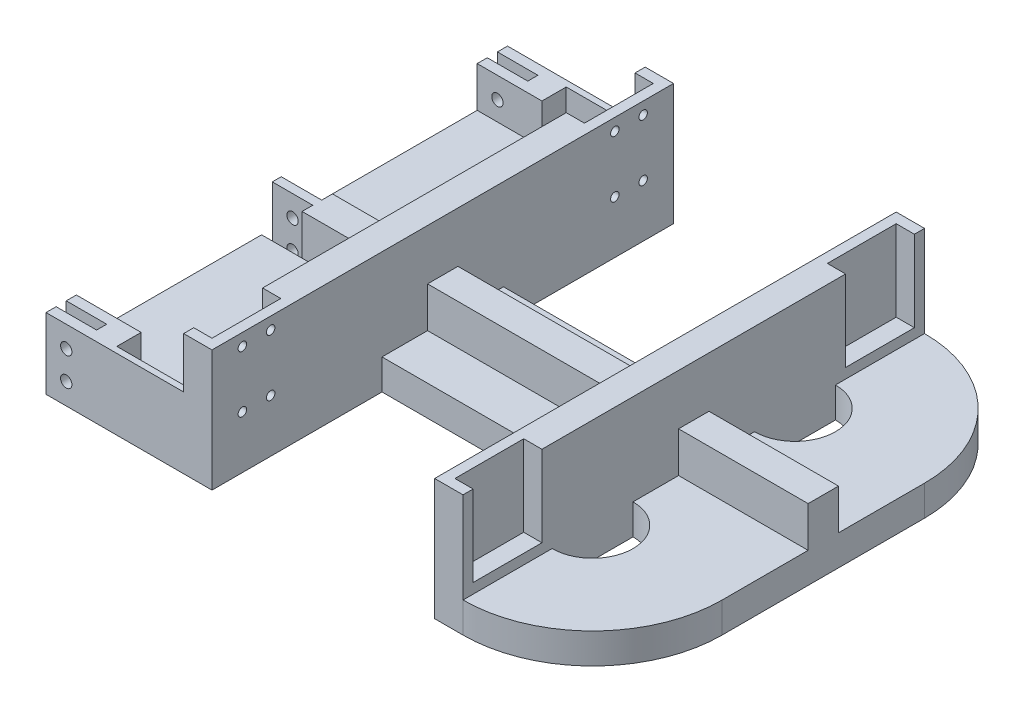
from build123d import *

# Parameters (mm, degrees)
BOSS_EXTRUDE1_DEPTH      = 2.5
BOSS_EXTRUDE1_DEPTH_BACK = 5
SKETCH3_W                = 7
SKETCH3_H                = 22
BOSS_EXTRUDE4_DEPTH      = 2.5
BOSS_EXTRUDE5_DEPTH      = 20
SKETCH7_R                = 3.75
BOSS_EXTRUDE6_DEPTH      = 5.5
SKETCH10_R               = 1.05
CUT_EXTRUDE1_DEPTH       = 2.5
SKETCH14_W               = 125
SKETCH14_H               = 7.5
SKETCH14_W_2             = 18
SKETCH14_H_2             = 1.5
BOSS_EXTRUDE8_DEPTH      = 10
SKETCH15_W               = 2.2
SKETCH15_H               = 17.5
SKETCH15_W_2             = 2.5
BOSS_EXTRUDE9_DEPTH      = 10
SKETCH16_R               = 1.4
CUT_EXTRUDE3_DEPTH       = 114
SKETCH17_W               = 7
SKETCH17_H               = 30
BOSS_EXTRUDE10_DEPTH     = 70
SKETCH18_W               = 45.75
SKETCH18_H               = 7.5
BOSS_EXTRUDE11_DEPTH     = 10


with BuildPart() as part:
    # Sketch2 → Boss-Extrude1 (new, two sides: drawn at the far end of the back side and taken through both)
    with BuildSketch(Plane(origin=(0, 0, 0), x_dir=(1, 0, 0), z_dir=(0, 1, 0)).offset(-BOSS_EXTRUDE1_DEPTH_BACK)):
        with BuildLine():
            Line((62.5, 25), (62.5, -25))
            ThreePointArc((62.5, -25), (53.127416998, -47.627416998), (30.5, -57))
            Line((30.5, -57), (23.5, -57))
            Line((23.5, -57), (23.5, -35))
            Line((23.5, -35), (30.5, -35))
            ThreePointArc((30.5, -35), (40.5, -25), (30.5, -15))
            Line((30.5, -15), (-38.5, -15))
            ThreePointArc((-38.5, -15), (-48.5, -25), (-38.5, -35))
            Line((-38.5, -35), (-31.5, -35))
            Line((-31.5, -35), (-31.5, -57))
            Line((-31.5, -57), (-38.5, -57))
            Line((-38.5, -57), (-62.5, -57))
            Line((-62.5, -57), (-62.5, 57))
            Line((-62.5, 57), (-38.5, 57))
            Line((-38.5, 57), (-31.5, 57))
            Line((-31.5, 57), (-31.5, 35))
            Line((-31.5, 35), (-38.5, 35))
            ThreePointArc((-38.5, 35), (-48.5, 25), (-38.5, 15))
            Line((-38.5, 15), (30.5, 15))
            ThreePointArc((30.5, 15), (40.5, 25), (30.5, 35))
            Line((30.5, 35), (23.5, 35))
            Line((23.5, 35), (23.5, 57))
            Line((23.5, 57), (30.5, 57))
            ThreePointArc((30.5, 57), (53.127416998, 47.627416998), (62.5, 25))
        make_face()
    extrude(amount=BOSS_EXTRUDE1_DEPTH + BOSS_EXTRUDE1_DEPTH_BACK)

    # Sketch3 → Boss-Extrude4 (add)
    with BuildSketch(Plane(origin=(0, 2.5, 0), x_dir=(1, 0, 0), z_dir=(0, 1, 0))):
        with Locations((-35, -46)):
            Rectangle(SKETCH3_W, SKETCH3_H)
        with Locations((27, -46)):
            Rectangle(SKETCH3_W, SKETCH3_H)
        with Locations((27, 46)):
            Rectangle(SKETCH3_W, SKETCH3_H)
        with Locations((-35, 46)):
            Rectangle(SKETCH3_W, SKETCH3_H)
    extrude(amount=BOSS_EXTRUDE4_DEPTH)

    # Sketch6 → Boss-Extrude5 (add)
    with BuildSketch(Plane(origin=(0, 5, 0), x_dir=(1, 0, 0), z_dir=(0, 1, 0))):
        Polygon((-38.5, -35), (-31.5, -35), (-31.5, -57), (-38.5, -57), (-38.5, -54.5), (-34, -54.5), (-34, -37.5), (-38.5, -37.5), align=None)
        Polygon((30.5, -35), (23.5, -35), (23.5, -57), (30.5, -57), (30.5, -54.5), (26, -54.5), (26, -37.5), (30.5, -37.5), align=None)
        Polygon((30.5, 37.5), (30.5, 35), (23.5, 35), (23.5, 57), (30.5, 57), (30.5, 54.5), (26, 54.5), (26, 37.5), align=None)
        Polygon((-38.5, 37.5), (-38.5, 35), (-31.5, 35), (-31.5, 57), (-38.5, 57), (-38.5, 54.5), (-34, 54.5), (-34, 37.5), align=None)
    extrude(amount=BOSS_EXTRUDE5_DEPTH)

    # Sketch7 → Boss-Extrude6 (add)
    with BuildSketch(Plane.ZY.offset(-23.5)):
        with Locations((46, 13.75)):
            Circle(SKETCH7_R)
        with Locations(Location((-46, 13.75, 0), (0, 0, 180))):
            Circle(SKETCH7_R)
    extrude(amount=BOSS_EXTRUDE6_DEPTH)

    # Sketch10 → Cut-Extrude1 (cut)
    with BuildSketch(Plane(origin=(-31.5, 0, 0), x_dir=(0, 0, -1), z_dir=(1, 0, 0))):
        with Locations((-42.5, 22)):
            Circle(SKETCH10_R)
        with Locations(Location((-49.5, 22, 0), (0, 0, 180))):
            Circle(SKETCH10_R)
        with Locations((-49.5, 8)):
            Circle(SKETCH10_R)
        with Locations(Location((-42.5, 8, 0), (0, 0, 180))):
            Circle(SKETCH10_R)
        with Locations((42.5, 8)):
            Circle(SKETCH10_R)
        with Locations(Location((49.5, 8, 0), (0, 0, 180))):
            Circle(SKETCH10_R)
        with Locations((49.5, 22)):
            Circle(SKETCH10_R)
        with Locations(Location((42.5, 22, 0), (0, 0, 180))):
            Circle(SKETCH10_R)
    extrude(amount=-CUT_EXTRUDE1_DEPTH, mode=Mode.SUBTRACT)

    # Sketch14 → Boss-Extrude8 (add)
    with BuildSketch(Plane(origin=(0, 2.5, 0), x_dir=(1, 0, 0), z_dir=(0, 1, 0))):
        Rectangle(SKETCH14_W, SKETCH14_H)
        Polygon((-56.5, -49.5), (-62.5, -49.5), (-62.5, -57), (-56.5, -57), (-56.5, -55.5), align=None)
        with Locations((-47.5, -56.25)):
            Rectangle(SKETCH14_W_2, SKETCH14_H_2)
        Polygon((-62.5, 57), (-62.5, 49.5), (-56.5, 49.5), (-56.5, 55.5), (-56.5, 57), align=None)
        with Locations((-47.5, 56.25)):
            Rectangle(SKETCH14_W_2, SKETCH14_H_2)
    extrude(amount=BOSS_EXTRUDE8_DEPTH)

    # Sketch15 → Boss-Extrude9 (add)
    with BuildSketch(Plane.ZY.offset(62.5)):
        with Locations((0, 3.75)):
            Rectangle(SKETCH15_W, SKETCH15_H)
        with Locations((55.75, 3.75)):
            Rectangle(SKETCH15_W_2, SKETCH15_H)
        with Locations((50.75, 3.75)):
            Rectangle(SKETCH15_W_2, SKETCH15_H)
        with Locations((-50.75, 3.75)):
            Rectangle(SKETCH15_W_2, SKETCH15_H)
        with Locations((-55.75, 3.75)):
            Rectangle(SKETCH15_W_2, SKETCH15_H)
    extrude(amount=BOSS_EXTRUDE9_DEPTH)

    # Sketch16 → Cut-Extrude3 (cut)
    with BuildSketch(Plane.XY.offset(57)):
        with Locations((-67.5, 7.25)):
            Circle(SKETCH16_R)
        with Locations((-67.5, 0.25)):
            Circle(SKETCH16_R)
    extrude(amount=-CUT_EXTRUDE3_DEPTH, mode=Mode.SUBTRACT)

    # Sketch17 → Boss-Extrude10 (add)
    with BuildSketch(Plane.XY.offset(-35)):
        with Locations((-35, 10)):
            Rectangle(SKETCH17_W, SKETCH17_H)
        with Locations((27, 10)):
            Rectangle(SKETCH17_W, SKETCH17_H)
    extrude(amount=BOSS_EXTRUDE10_DEPTH)

    # Sketch18 → Boss-Extrude11 (add)
    with BuildSketch(Plane.ZY.offset(62.5)):
        with Locations((-26.625, -1.25)):
            Rectangle(SKETCH18_W, SKETCH18_H)
        with Locations((26.625, -1.25)):
            Rectangle(SKETCH18_W, SKETCH18_H)
    extrude(amount=BOSS_EXTRUDE11_DEPTH)


solid = part.part
